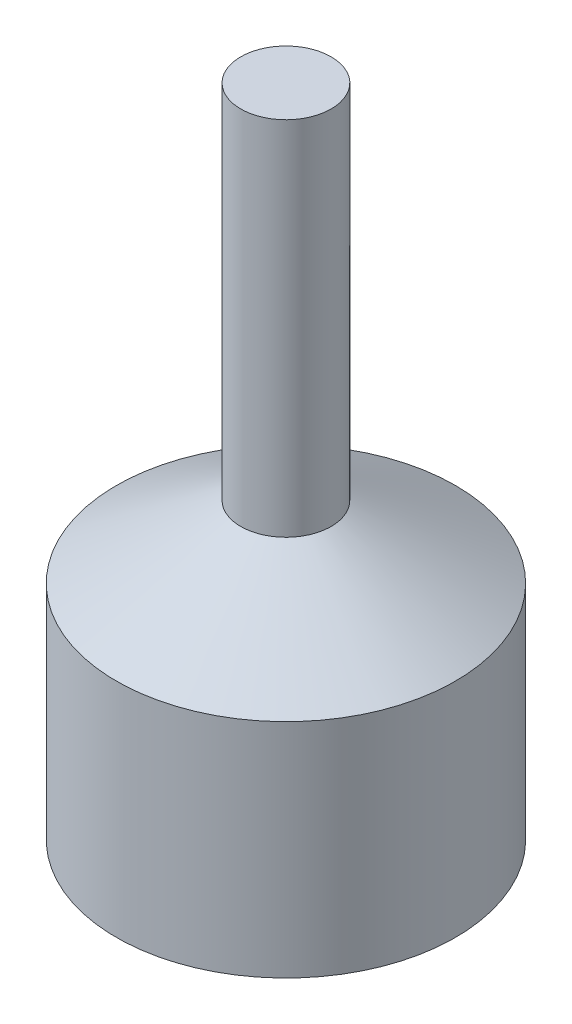
from build123d import *


with BuildPart() as part:
    # Sketch1 → Revolve1 (revolve)
    with BuildSketch(Plane(origin=(0, 0, 0), x_dir=(0, 0, -1), z_dir=(1, 0, 0))):
        Polygon((0, 95.25), (6.35, 95.25), (6.35, 44.45), (23.8125, 34.368020924), (23.8125, 3.175), (19.05, 3.175), (19.05, 0), (0, 0), align=None)
    revolve(axis=Axis((0, 0, 0), (0, 1, 0)))


solid = part.part
